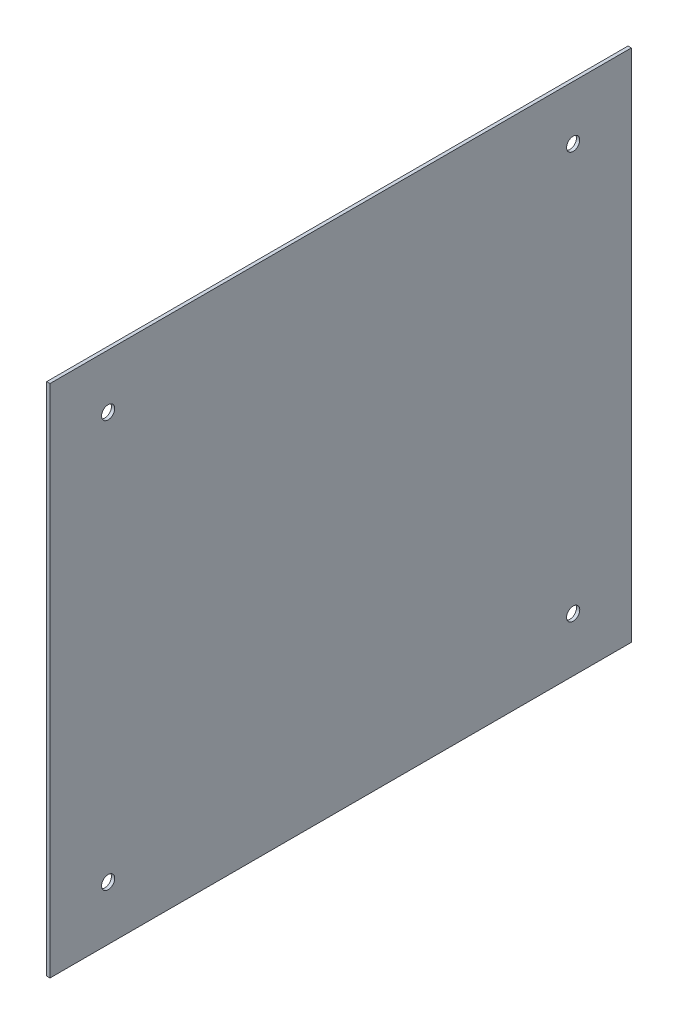
from build123d import *

# Parameters (mm, degrees)
SKETCH1_W           = 350
SKETCH1_H           = 310
BOSS_EXTRUDE1_DEPTH = 2
SKETCH2_R           = 3.97
CUT_EXTRUDE1_DEPTH  = 234.781949688


with BuildPart() as part:
    # Sketch1 → Boss-Extrude1 (new body)
    with BuildSketch(Plane(origin=(0, 0, 0), x_dir=(0, 0, -1), z_dir=(1, 0, 0))):
        Rectangle(SKETCH1_W, SKETCH1_H)
    extrude(amount=BOSS_EXTRUDE1_DEPTH)

    # Sketch2 → Cut-Extrude1 (cut, through all)
    with BuildSketch(Plane(origin=(2, 0, 0), x_dir=(0, 0, -1), z_dir=(1, 0, 0))):
        with Locations((-140, 122.5)):
            Circle(SKETCH2_R)
        with Locations(Location((-140, -122.5, 0), (0, 0, 180))):
            Circle(SKETCH2_R)
        with Locations((140, -122.5)):
            Circle(SKETCH2_R)
        with Locations(Location((140, 122.5, 0), (0, 0, 180))):
            Circle(SKETCH2_R)
    extrude(amount=-CUT_EXTRUDE1_DEPTH, mode=Mode.SUBTRACT)


solid = part.part
